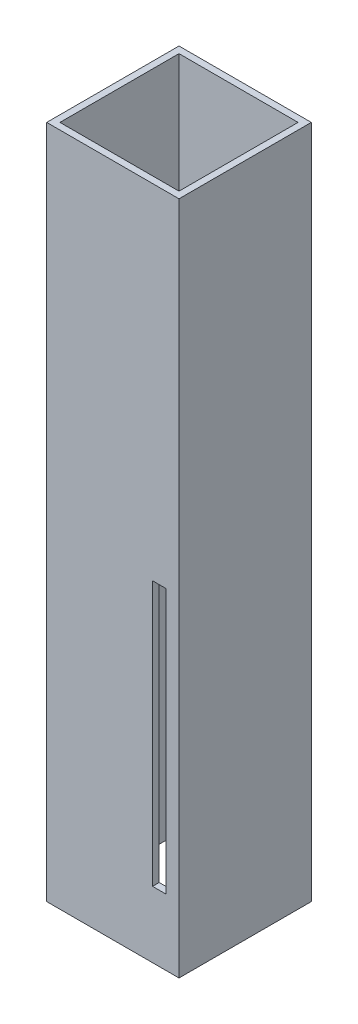
from build123d import *

# Parameters (mm, degrees)
SKETCH1_W               = 5
SKETCH1_H               = 5
SKETCH1_W_2             = 4.5
SKETCH1_H_2             = 4.5
BOSS_EXTRUDE1_DEPTH     = 25.5
CUT_EXTRUDE1_DEPTH      = 27.105554964
CUT_EXTRUDE1_DEPTH_BACK = 27.105554964
SKETCH2_W               = 0.5
SKETCH2_H               = 10


with BuildPart() as part:
    # Sketch1 → Boss-Extrude1 (new body)
    with BuildSketch(Plane(origin=(0, 0, 0), x_dir=(1, 0, 0), z_dir=(0, 1, 0))):
        Rectangle(SKETCH1_W, SKETCH1_H)
        Rectangle(SKETCH1_W_2, SKETCH1_H_2, mode=Mode.SUBTRACT)
    extrude(amount=BOSS_EXTRUDE1_DEPTH)

    # Sketch2 → Cut-Extrude1 (cut, two sides: drawn at the far end of the back side and taken through both)
    with BuildSketch(Plane.XY.offset(2.5).offset(-CUT_EXTRUDE1_DEPTH_BACK)):
        with Locations((1.75, 7.5)):
            Rectangle(SKETCH2_W, SKETCH2_H)
    extrude(amount=CUT_EXTRUDE1_DEPTH + CUT_EXTRUDE1_DEPTH_BACK, mode=Mode.SUBTRACT)


solid = part.part
